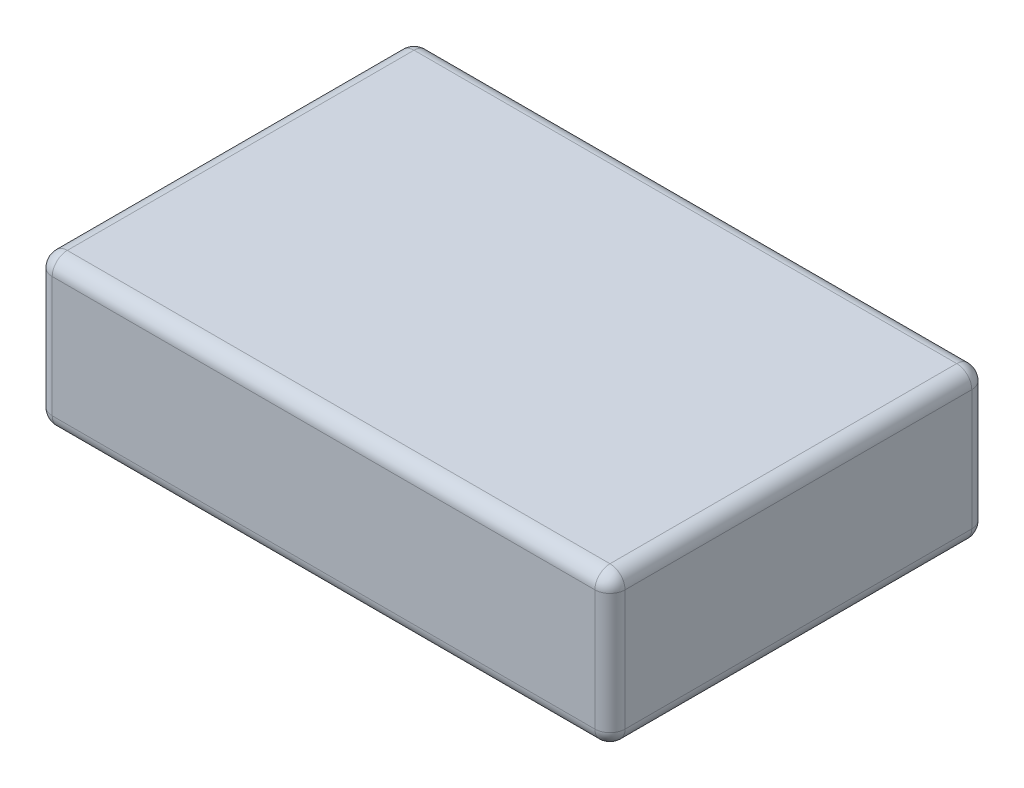
from build123d import *

# Parameters (mm, degrees)
SKETCH_1_W      = 76
SKETCH_1_H      = 50
EXTRUDE_1_DEPTH = 20
FILLET_1_R      = 2


with BuildPart() as part:
    # 草图1 → 凸台-拉伸1 (new body)
    with BuildSketch(Plane(origin=(0, 0, 0), x_dir=(1, 0, 0), z_dir=(0, 1, 0))):
        with Locations((38, -25)):
            Rectangle(SKETCH_1_W, SKETCH_1_H)
    extrude(amount=EXTRUDE_1_DEPTH)

    # 圆角1
    fillet_1_edges = [part.edges().sort_by_distance(p)[0] for p in [
        (76, 20, 25),
        (38, 20, 0),
        (0, 20, 25),
        (38, 0, 0),
        (76, 0, 25),
        (38, 0, 50),
        (0, 0, 25),
        (0, 10, 0),
        (76, 10, 0),
        (76, 10, 50),
        (0, 10, 50),
        (38, 20, 50),
    ]]
    fillet(fillet_1_edges, radius=FILLET_1_R)


solid = part.part
